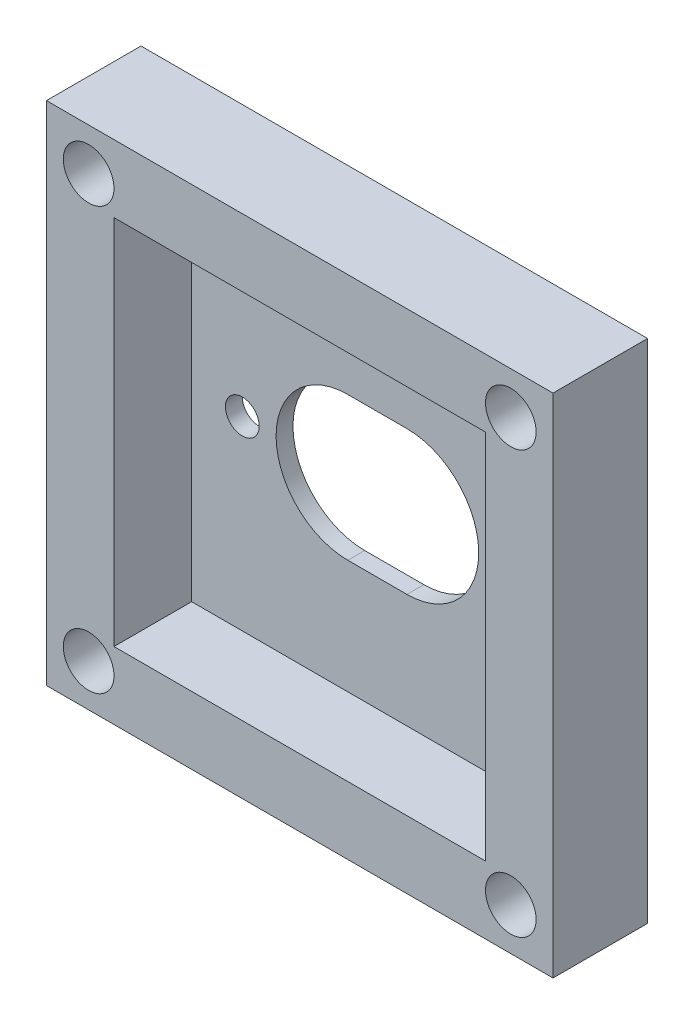
from build123d import *

# Parameters (mm, degrees)
CROQUIS1_W              = 30
CROQUIS1_H              = 30
CROQUIS1_R              = 1
SALIENTE_EXTRUIR2_DEPTH = 1
CROQUIS2_W              = 30
CROQUIS2_H              = 30
CROQUIS2_W_2            = 22
CROQUIS2_H_2            = 22
SALIENTE_EXTRUIR3_DEPTH = 10
CROQUIS4_R              = 1.5
CORTAR_EXTRUIR2_DEPTH   = 44
CROQUIS5_W              = 5.4
CROQUIS5_H              = 30
CORTAR_EXTRUIR3_DEPTH   = 46


with BuildPart() as part:
    # Croquis1 → Saliente-Extruir2 (new body)
    with BuildSketch(Plane.XY):
        Rectangle(CROQUIS1_W, CROQUIS1_H)
        with Locations((-8, 0)):
            Circle(CROQUIS1_R, mode=Mode.SUBTRACT)
        with Locations((8, 0)):
            Circle(CROQUIS1_R, mode=Mode.SUBTRACT)
        with BuildLine():
            Line((-1.75, 4.25), (1.75, 4.25))
            ThreePointArc((1.75, 4.25), (6, 0), (1.75, -4.25))
            Line((1.75, -4.25), (-1.75, -4.25))
            ThreePointArc((-1.75, -4.25), (-6, 0), (-1.75, 4.25))
        make_face(mode=Mode.SUBTRACT)
    extrude(amount=-SALIENTE_EXTRUIR2_DEPTH)

    # Croquis2 → Saliente-Extruir3 (add)
    with BuildSketch(Plane.XY):
        Rectangle(CROQUIS2_W, CROQUIS2_H)
        Rectangle(CROQUIS2_W_2, CROQUIS2_H_2, mode=Mode.SUBTRACT)
    extrude(amount=SALIENTE_EXTRUIR3_DEPTH)

    # Croquis4 → Cortar-Extruir2 (cut)
    with BuildSketch(Plane.XY.offset(10)):
        with Locations((-12.5, 12.5)):
            Circle(CROQUIS4_R)
        with Locations((12.5, 12.5)):
            Circle(CROQUIS4_R)
        with Locations((12.5, -12.5)):
            Circle(CROQUIS4_R)
        with Locations((-12.5, -12.5)):
            Circle(CROQUIS4_R)
    extrude(amount=-CORTAR_EXTRUIR2_DEPTH, mode=Mode.SUBTRACT)

    # Croquis5 → Cortar-Extruir3 (cut)
    with BuildSketch(Plane.ZY.offset(15)):
        with Locations((7.3, 0)):
            Rectangle(CROQUIS5_W, CROQUIS5_H)
    extrude(amount=-CORTAR_EXTRUIR3_DEPTH, mode=Mode.SUBTRACT)


solid = part.part
